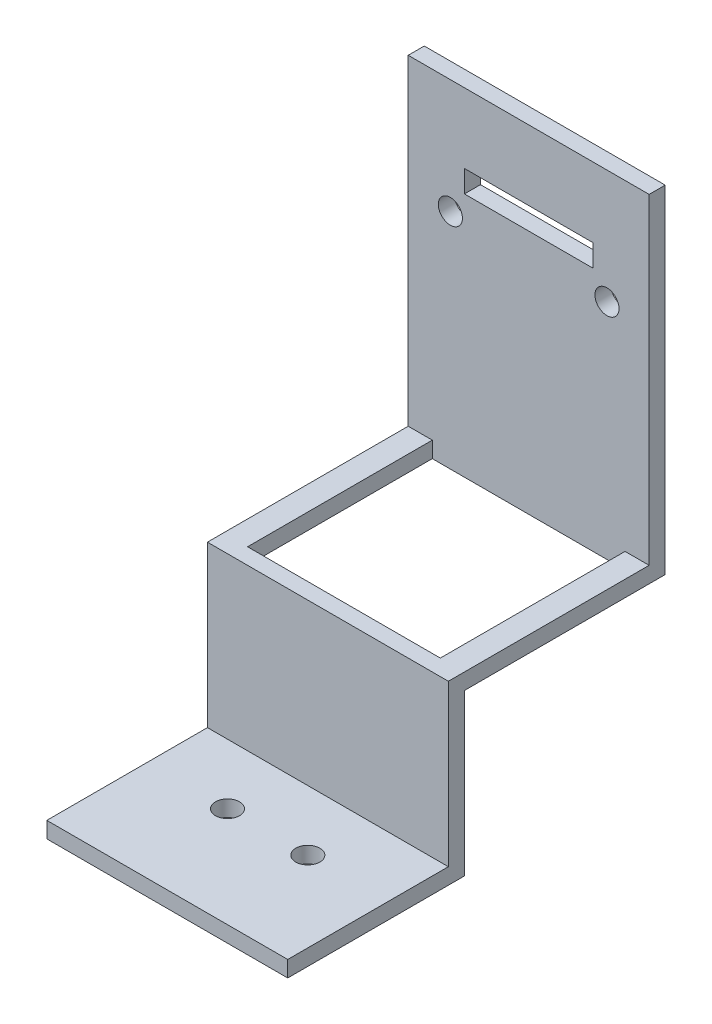
from build123d import *

# Parameters (mm, degrees)
SKETCH1_W           = 30
SKETCH1_H           = 40
BOSS_EXTRUDE1_DEPTH = 2
BOSS_EXTRUDE3_DEPTH = 30
SKETCH6_W           = 24
SKETCH6_H           = 23
CUT_EXTRUDE2_DEPTH  = 2
SKETCH7_R           = 1.5
SKETCH7_W           = 16
SKETCH7_H           = 2.75
CUT_EXTRUDE3_DEPTH  = 10
SKETCH9_R           = 1.5
CUT_EXTRUDE4_DEPTH  = 10


with BuildPart() as part:
    # Sketch1 → Boss-Extrude1 (new body)
    with BuildSketch(Plane.XY):
        with Locations((15, 20)):
            Rectangle(SKETCH1_W, SKETCH1_H)
    extrude(amount=BOSS_EXTRUDE1_DEPTH)

    # Sketch5 → Boss-Extrude3 (add)
    with BuildSketch(Plane(origin=(0, 0, 0), x_dir=(0, 0, -1), z_dir=(1, 0, 0))):
        Polygon((-27, -20), (-47, -20), (-47, -22), (-26.3, -22), (-25, -22), (-25, -2), (0, -2), (0, 0), (-2, 0), (-27, 0), align=None)
    extrude(amount=BOSS_EXTRUDE3_DEPTH)

    # Sketch6 → Cut-Extrude2 (cut)
    with BuildSketch(Plane(origin=(0, 0, 0), x_dir=(1, 0, 0), z_dir=(0, 1, 0))):
        with Locations((15, -13.5)):
            Rectangle(SKETCH6_W, SKETCH6_H)
    extrude(amount=-CUT_EXTRUDE2_DEPTH, mode=Mode.SUBTRACT)

    # Sketch7 → Cut-Extrude3 (cut)
    with BuildSketch(Plane(origin=(0, 0, 0), x_dir=(-1, 0, 0), z_dir=(0, 0, -1))):
        with Locations((-24.75, 25.797552116)):
            Circle(SKETCH7_R)
        with Locations((-5.25, 25.797552116)):
            Circle(SKETCH7_R)
        with Locations((-15, 29.922552116)):
            Rectangle(SKETCH7_W, SKETCH7_H)
    extrude(amount=-CUT_EXTRUDE3_DEPTH, mode=Mode.SUBTRACT)

    # Sketch9 → Cut-Extrude4 (cut)
    with BuildSketch(Plane.XZ.offset(22)):
        with Locations(Location((20, 34.5, 0), (0, 0, 270))):
            Circle(SKETCH9_R)
        with Locations(Location((10, 34.5, 0), (0, 0, 270))):
            Circle(SKETCH9_R)
    extrude(amount=-CUT_EXTRUDE4_DEPTH, mode=Mode.SUBTRACT)


solid = part.part
